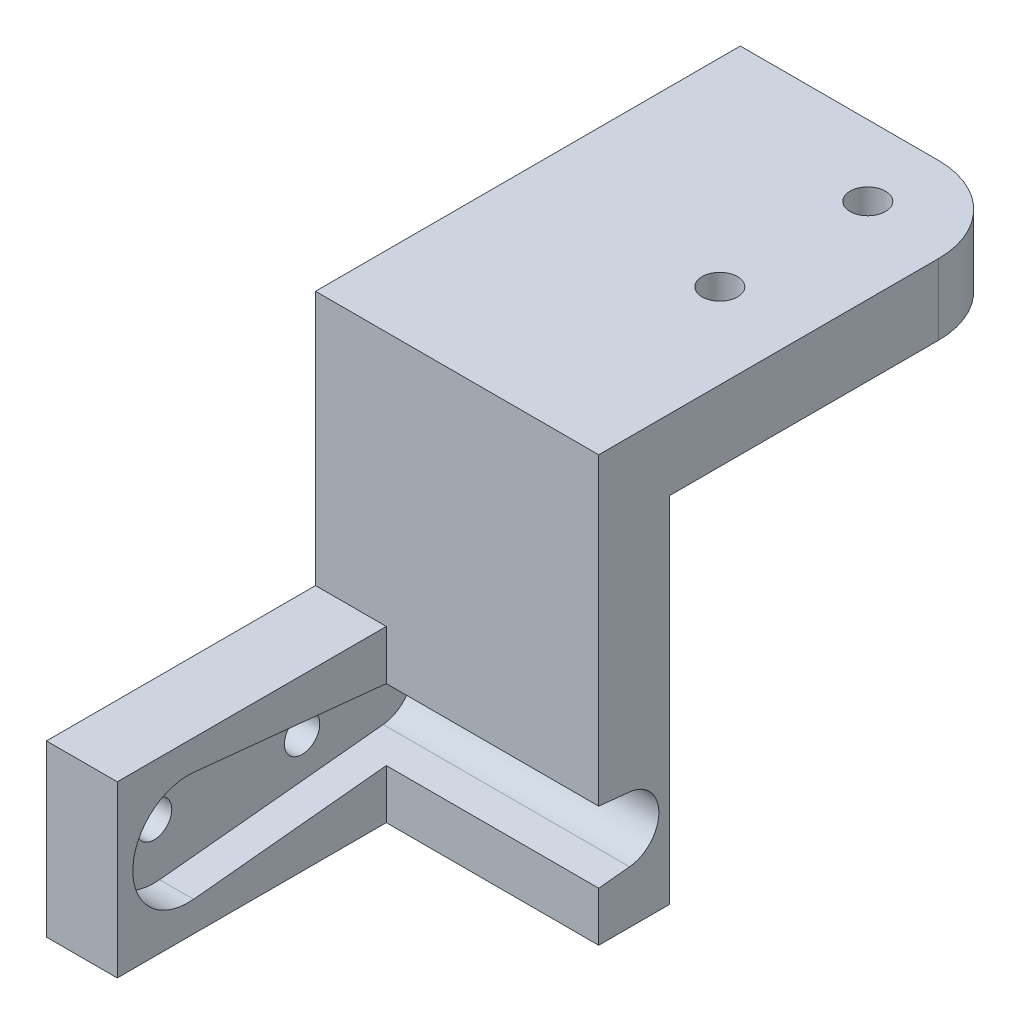
from build123d import *

# Parameters (mm, degrees)
SKETCH1_W               = 20
SKETCH1_H               = 30
BOSS_EXTRUDE1_DEPTH     = 5
CUT_EXTRUDE1_DEPTH      = 2.4
SKETCH7_R               = 1.25
CUT_EXTRUDE4_DEPTH      = 19.214280112
BOSS_EXTRUDE2_DEPTH     = 10
SKETCH5_W               = 19
SKETCH5_H               = 12
CUT_EXTRUDE2_DEPTH      = 15
CUT_EXTRUDE3_DEPTH      = 45.788391353
CUT_EXTRUDE3_DEPTH_BACK = 2.4
SKETCH8_R               = 1.25
CUT_EXTRUDE5_DEPTH      = 46.648220119
FILLET1_R               = 6


with BuildPart() as part:
    # Sketch1 → Boss-Extrude1 (new body)
    with BuildSketch(Plane(origin=(0, 0, 0), x_dir=(1, 0, 0), z_dir=(0, 1, 0))):
        Rectangle(SKETCH1_W, SKETCH1_H)
    extrude(amount=BOSS_EXTRUDE1_DEPTH)

    # Sketch2 → Cut-Extrude1 (cut)
    with BuildSketch(Plane.XZ):
        with BuildLine():
            Line((0.119672063, -9.608777429), (1.711601473, 6.180721003))
            ThreePointArc((1.711601473, 6.180721003), (4, 8.25), (6.288398527, 6.180721003))
            Line((6.288398527, 6.180721003), (7.880327937, -9.608777429))
            ThreePointArc((7.880327937, -9.608777429), (4, -13.9), (0.119672063, -9.608777429))
        make_face()
    extrude(amount=-CUT_EXTRUDE1_DEPTH, mode=Mode.SUBTRACT)

    # Sketch7 → Cut-Extrude4 (cut, through all)
    with BuildSketch(Plane.XZ.offset(-2.4)):
        with Locations(Location((4, -10, 0), (0, 0, 270))):
            Circle(SKETCH7_R)
        with Locations(Location((4, 0.45, 0), (0, 0, 270))):
            Circle(SKETCH7_R)
    extrude(amount=-CUT_EXTRUDE4_DEPTH, mode=Mode.SUBTRACT)

    # Sketch4 → Boss-Extrude2 (add, symmetric)
    with BuildSketch(Plane(origin=(0, 0, 0), x_dir=(0, 0, -1), z_dir=(1, 0, 0))):
        Polygon((-15, 0), (-10, 0), (-10, -25), (-15, -25), (-34, -25), (-34, -13), (-15, -13), align=None)
    extrude(amount=BOSS_EXTRUDE2_DEPTH, both=True)

    # Sketch5 → Cut-Extrude2 (cut)
    with BuildSketch(Plane(origin=(10, 0, 0), x_dir=(0, 0, -1), z_dir=(1, 0, 0))):
        with Locations((-24.5, -19)):
            Rectangle(SKETCH5_W, SKETCH5_H)
    extrude(amount=-CUT_EXTRUDE2_DEPTH, mode=Mode.SUBTRACT)

    # Sketch6 → Cut-Extrude3 (cut, two sides: drawn at the far end of the back side and taken through both)
    with BuildSketch(Plane(origin=(-5, 0, 0), x_dir=(0, 0, -1), z_dir=(1, 0, 0)).offset(-CUT_EXTRUDE3_DEPTH_BACK)):
        with BuildLine():
            Line((-28.608777429, -22.880327937), (-12.819278997, -21.288398527))
            ThreePointArc((-12.819278997, -21.288398527), (-10.75, -19), (-12.819278997, -16.711601473))
            Line((-12.819278997, -16.711601473), (-28.608777429, -15.119672063))
            ThreePointArc((-28.608777429, -15.119672063), (-32.9, -19), (-28.608777429, -22.880327937))
        make_face()
    extrude(amount=CUT_EXTRUDE3_DEPTH + CUT_EXTRUDE3_DEPTH_BACK, mode=Mode.SUBTRACT)

    # Sketch8 → Cut-Extrude5 (cut, through all)
    with BuildSketch(Plane(origin=(-7.4, 0, 0), x_dir=(0, 0, -1), z_dir=(1, 0, 0))):
        with Locations((-29, -19)):
            Circle(SKETCH8_R)
        with Locations((-18.55, -19)):
            Circle(SKETCH8_R)
    extrude(amount=-CUT_EXTRUDE5_DEPTH, mode=Mode.SUBTRACT)

    # Fillet1
    fillet1_edges = [part.edges().sort_by_distance(p)[0] for p in [
        (10, 2.5, -15),
    ]]
    fillet(fillet1_edges, radius=FILLET1_R)


solid = part.part
